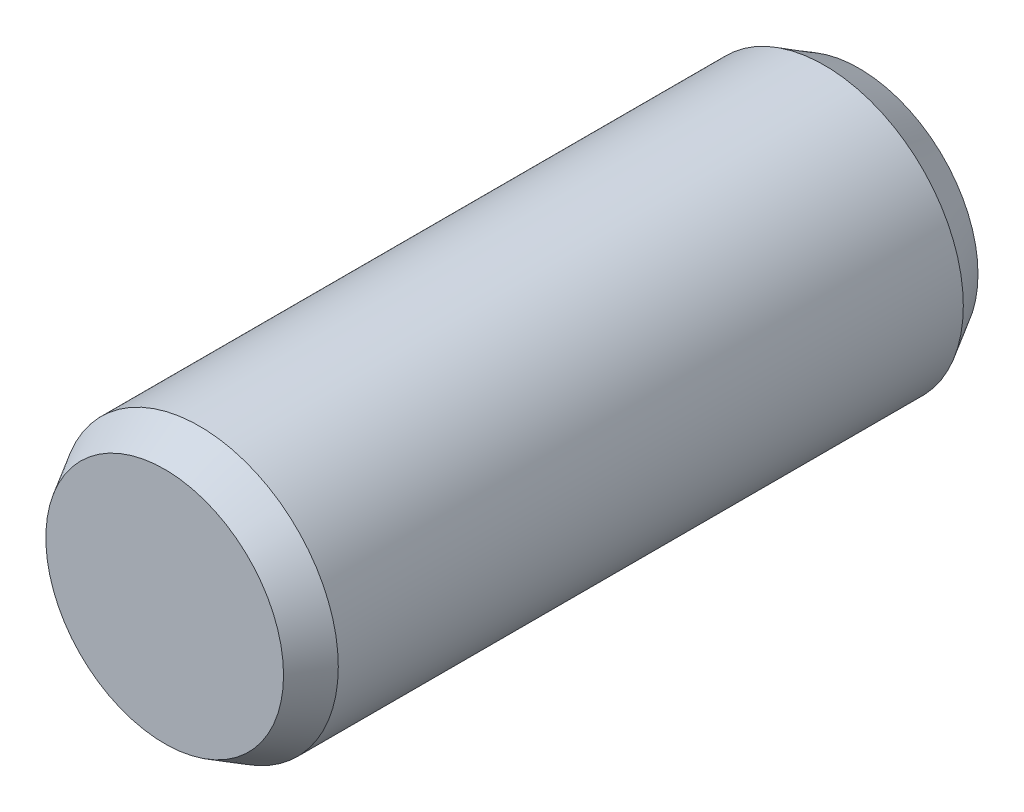
from build123d import *

# Parameters (mm, degrees)
SKETCH1_R           = 2
BOSS_EXTRUDE1_DEPTH = 10
CHAMFER1_SIZE       = 0.5
CHAMFER1_SIZE2      = 0.288675135


with BuildPart() as part:
    # Sketch1 → Boss-Extrude1 (new body)
    with BuildSketch(Plane.XY):
        Circle(SKETCH1_R)
    extrude(amount=BOSS_EXTRUDE1_DEPTH)

    # Chamfer1
    chamfer1_edges = [part.edges().sort_by_distance(p)[0] for p in [
        (-2, 0, 0),
        (-2, 0, 10),
    ]]
    chamfer1_side = [part.faces().sort_by_distance(p)[0] for p in [
        (-2, 0, 5),
    ]]
    chamfer(chamfer1_edges, length=CHAMFER1_SIZE, length2=CHAMFER1_SIZE2, reference=chamfer1_side[0])


solid = part.part
